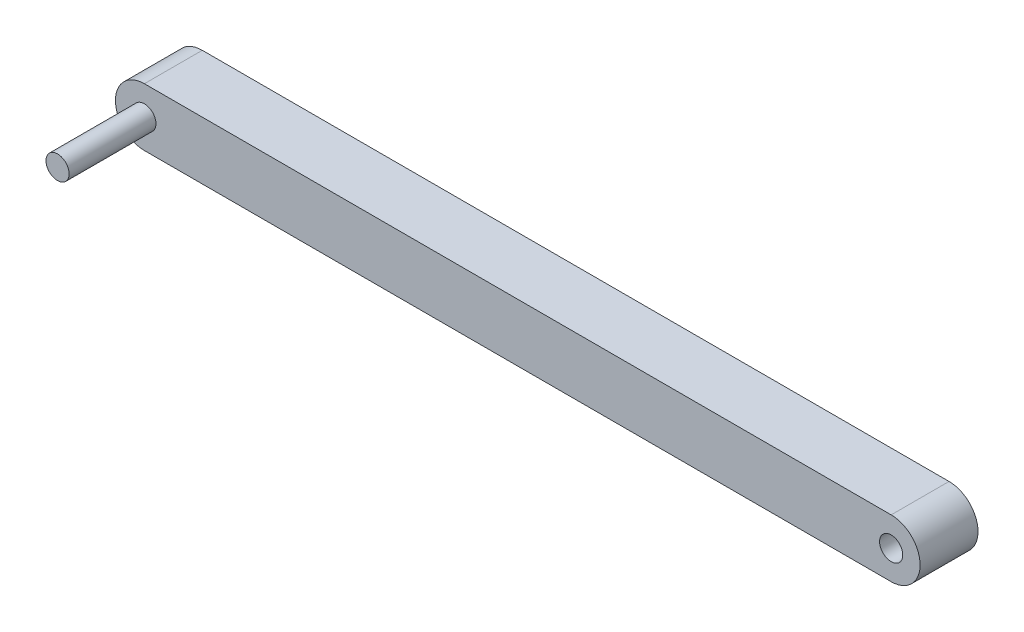
from build123d import *

# Parameters (mm, degrees)
BOSS_EXTRUDE1_DEPTH = 100
SKETCH3_R           = 20
CUT_EXTRUDE1_DEPTH  = 100
SKETCH2_R           = 20
BOSS_EXTRUDE3_DEPTH = 150


with BuildPart() as part:
    # Sketch1 → Boss-Extrude1 (new body)
    with BuildSketch(Plane.XY):
        with BuildLine():
            Line((0, 0), (1290, 0))
            ThreePointArc((1290, 0), (1340, 50), (1290, 100))
            Line((1290, 100), (0, 100))
            ThreePointArc((0, 100), (-50, 50), (0, 0))
        make_face()
    extrude(amount=BOSS_EXTRUDE1_DEPTH)

    # Sketch3 → Cut-Extrude1 (cut)
    with BuildSketch(Plane.XY.offset(100)):
        with Locations((1290, 50)):
            Circle(SKETCH3_R)
    extrude(amount=-CUT_EXTRUDE1_DEPTH, mode=Mode.SUBTRACT)

    # Sketch2 → Boss-Extrude3 (add)
    with BuildSketch(Plane.XY.offset(100)):
        with Locations((0, 50)):
            Circle(SKETCH2_R)
    extrude(amount=BOSS_EXTRUDE3_DEPTH)


solid = part.part
